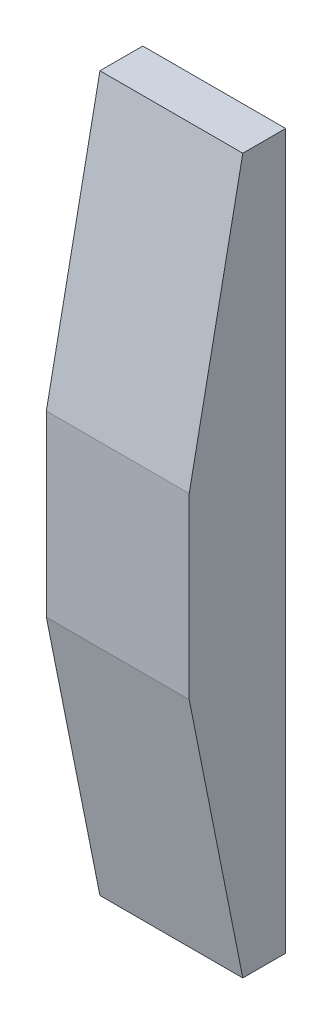
from build123d import *

# Parameters (mm, degrees)
BOSS_EXTRUDE1_DEPTH = 200
SKETCH4_W           = 200
SKETCH4_H           = 1000
BOSS_EXTRUDE2_DEPTH = 60


with BuildPart() as part:
    # Sketch3 → Boss-Extrude1 (new body)
    with BuildSketch(Plane.ZY.offset(1220)):
        Polygon((0, 500), (75, 125), (75, -125), (0, -500), align=None)
    extrude(amount=-BOSS_EXTRUDE1_DEPTH)

    # Sketch4 → Boss-Extrude2 (add)
    with BuildSketch(Plane(origin=(0, 0, 0), x_dir=(-1, 0, 0), z_dir=(0, 0, -1))):
        with Locations((1120, 0)):
            Rectangle(SKETCH4_W, SKETCH4_H)
    extrude(amount=BOSS_EXTRUDE2_DEPTH)


solid = part.part
